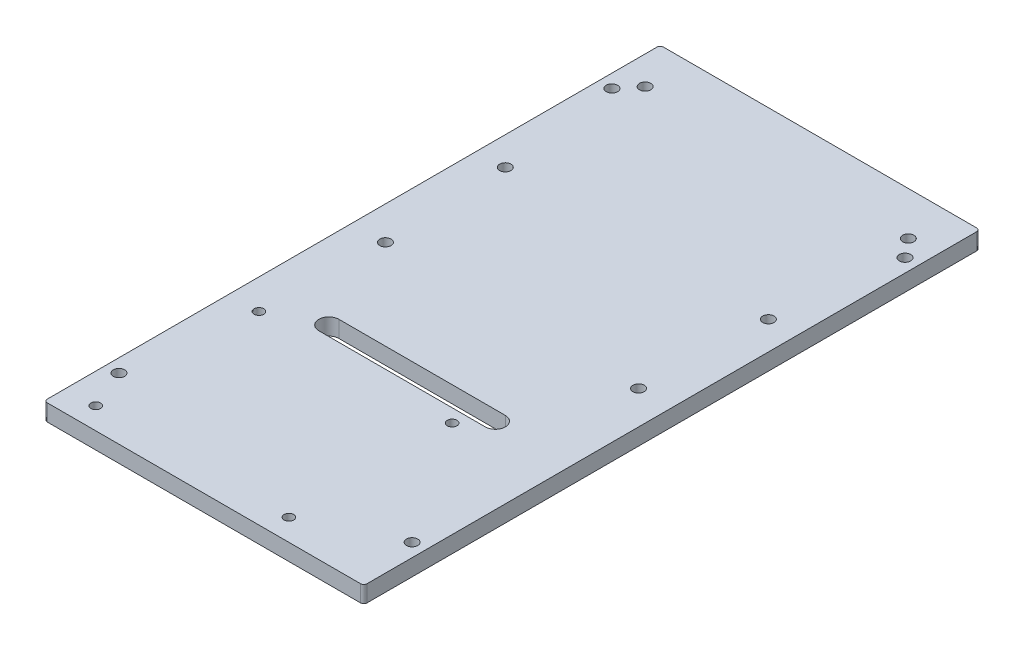
from build123d import *

# Parameters (mm, degrees)
SKETCH1_W               = 96
SKETCH1_H               = 185
PLATE_DEPTH             = 5
STANDOFF_HOLES_REACH    = 106.332
SKETCH2_R               = 1.7
POWER_BOARD_HOLES_REACH = 106.332
SKETCH3_R               = 1.7
FILLET1_R               = 1
M2_5_CLEARANCE_HOLE1_D  = 2.9
M3_CLEARANCE_HOLE2_D    = 3.4
CUT_EXTRUDE1_REACH      = 106.332


with BuildPart() as part:
    # Sketch1 → plate (new body)
    with BuildSketch(Plane(origin=(0, 0, 0), x_dir=(1, 0, 0), z_dir=(0, 1, 0))):
        Rectangle(SKETCH1_W, SKETCH1_H)
    extrude(amount=PLATE_DEPTH)

    # Sketch2 → standoff-holes (cut, up to next)
    with BuildSketch(Plane(origin=(0, 5, 0), x_dir=(1, 0, 0), z_dir=(0, 1, 0)), mode=Mode.PRIVATE) as standoff_holes_sk1:
        with Locations(Location((44, 74, 0), (0, 0, 270))):
            Circle(SKETCH2_R)
    standoff_holes_tool1 = extrude(standoff_holes_sk1.sketch, amount=-STANDOFF_HOLES_REACH, mode=Mode.PRIVATE) & part.part
    # Sketch2 → standoff-holes (cut, up to next)
    with BuildSketch(Plane(origin=(0, 5, 0), x_dir=(1, 0, 0), z_dir=(0, 1, 0)), mode=Mode.PRIVATE) as standoff_holes_sk2:
        with Locations(Location((-44, 74, 0), (0, 0, 270))):
            Circle(SKETCH2_R)
    standoff_holes_tool2 = extrude(standoff_holes_sk2.sketch, amount=-STANDOFF_HOLES_REACH, mode=Mode.PRIVATE) & part.part
    # Sketch2 → standoff-holes (cut, up to next)
    with BuildSketch(Plane(origin=(0, 5, 0), x_dir=(1, 0, 0), z_dir=(0, 1, 0)), mode=Mode.PRIVATE) as standoff_holes_sk3:
        with Locations(Location((44, -74, 0), (0, 0, 270))):
            Circle(SKETCH2_R)
    standoff_holes_tool3 = extrude(standoff_holes_sk3.sketch, amount=-STANDOFF_HOLES_REACH, mode=Mode.PRIVATE) & part.part
    # Sketch2 → standoff-holes (cut, up to next)
    with BuildSketch(Plane(origin=(0, 5, 0), x_dir=(1, 0, 0), z_dir=(0, 1, 0)), mode=Mode.PRIVATE) as standoff_holes_sk4:
        with Locations(Location((-44, -74, 0), (0, 0, 270))):
            Circle(SKETCH2_R)
    standoff_holes_tool4 = extrude(standoff_holes_sk4.sketch, amount=-STANDOFF_HOLES_REACH, mode=Mode.PRIVATE) & part.part
    add(standoff_holes_tool1.solids().sort_by_distance((44, 5, -74))[0], mode=Mode.SUBTRACT)
    add(standoff_holes_tool2.solids().sort_by_distance((-44, 5, -74))[0], mode=Mode.SUBTRACT)
    add(standoff_holes_tool3.solids().sort_by_distance((44, 5, 74))[0], mode=Mode.SUBTRACT)
    add(standoff_holes_tool4.solids().sort_by_distance((-44, 5, 74))[0], mode=Mode.SUBTRACT)

    # Sketch3 → power-board-holes (cut, up to next)
    with BuildSketch(Plane(origin=(0, 5, 0), x_dir=(1, 0, 0), z_dir=(0, 1, 0)), mode=Mode.PRIVATE) as power_board_holes_sk1:
        with Locations(Location((38, 0, 0), (0, 0, 270))):
            Circle(SKETCH3_R)
    power_board_holes_tool1 = extrude(power_board_holes_sk1.sketch, amount=-POWER_BOARD_HOLES_REACH, mode=Mode.PRIVATE) & part.part
    # Sketch3 → power-board-holes (cut, up to next)
    with BuildSketch(Plane(origin=(0, 5, 0), x_dir=(1, 0, 0), z_dir=(0, 1, 0)), mode=Mode.PRIVATE) as power_board_holes_sk2:
        with Locations(Location((-38, 0, 0), (0, 0, 270))):
            Circle(SKETCH3_R)
    power_board_holes_tool2 = extrude(power_board_holes_sk2.sketch, amount=-POWER_BOARD_HOLES_REACH, mode=Mode.PRIVATE) & part.part
    add(power_board_holes_tool1.solids().sort_by_distance((38, 5, 0))[0], mode=Mode.SUBTRACT)
    add(power_board_holes_tool2.solids().sort_by_distance((-38, 5, 0))[0], mode=Mode.SUBTRACT)

    # Fillet1
    fillet1_edges = [part.edges().sort_by_distance(p)[0] for p in [
        (48, 2.5, 92.5),
        (-48, 2.5, 92.5),
        (-48, 2.5, -92.5),
        (48, 2.5, -92.5),
    ]]
    fillet(fillet1_edges, radius=FILLET1_R)

    # M2.5 Clearance Hole1 (through all)
    with Locations(Plane(origin=(0, 5, 0), x_dir=(1, 0, 0), z_dir=(0, 1, 0))):
        with Locations((-39, -85.98), (19, -85.98), (-39, -36.98), (19, -36.98)):
            Hole(M2_5_CLEARANCE_HOLE1_D / 2)

    # M3 Clearance Hole2 (through all)
    with Locations(Plane(origin=(0, 5, 0), x_dir=(1, 0, 0), z_dir=(0, 1, 0))):
        with Locations((-39.49999847, 79.47999944), (-39.49999847, 37.47999962), (39.50000101, 37.47999962), (39.50000101, 79.47999944)):
            Hole(M3_CLEARANCE_HOLE2_D / 2)

    # Sketch12 → Cut-Extrude1 (cut, up to next)
    with BuildSketch(Plane(origin=(0, 5, 0), x_dir=(1, 0, 0), z_dir=(0, 1, 0)), mode=Mode.PRIVATE) as cut_extrude1_sk1:
        with BuildLine():
            Line((-25, -27), (25, -27))
            ThreePointArc((25, -27), (28, -30), (25, -33))
            Line((25, -33), (-25, -33))
            ThreePointArc((-25, -33), (-28, -30), (-25, -27))
        make_face()
    cut_extrude1_tool1 = extrude(cut_extrude1_sk1.sketch, amount=-CUT_EXTRUDE1_REACH, mode=Mode.PRIVATE) & part.part
    add(cut_extrude1_tool1.solids().sort_by_distance((0, 5, 30))[0], mode=Mode.SUBTRACT)


solid = part.part
